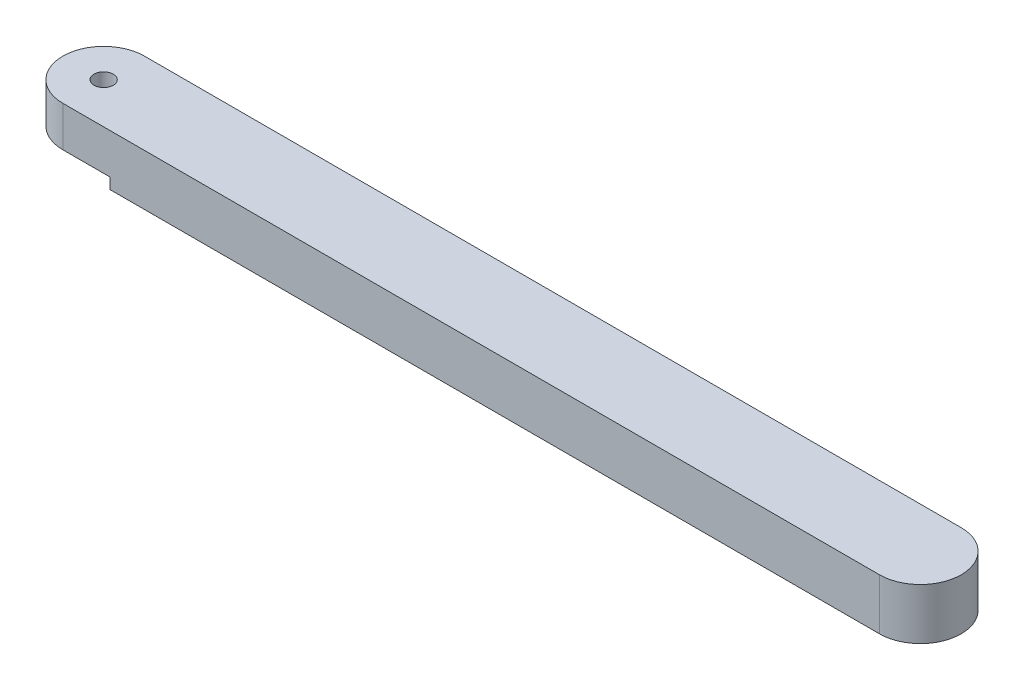
from build123d import *

# Parameters (mm, degrees)
BOSS_EXTRUDE1_DEPTH        = 11.938
F_4_5_4_5_DIAMETER_HOLE1_D = 4.5
CUT_EXTRUDE1_DEPTH         = 2.54


with BuildPart() as part:
    # Sketch1 → Boss-Extrude1 (new body)
    with BuildSketch(Plane(origin=(0, 0, 0), x_dir=(1, 0, 0), z_dir=(0, 1, 0))):
        with BuildLine():
            Line((0, 9.525), (190.5, 9.525))
            ThreePointArc((190.5, 9.525), (200.025, 0), (190.5, -9.525))
            Line((190.5, -9.525), (0, -9.525))
            ThreePointArc((0, -9.525), (-9.525, 0), (0, 9.525))
        make_face()
    extrude(amount=BOSS_EXTRUDE1_DEPTH)

    # Ø4.5 (4.5) Diameter Hole1 (through all)
    with Locations(Plane(origin=(0, 11.938, 0), x_dir=(1, 0, 0), z_dir=(0, 1, 0))):
        with Locations((0, 0)):
            Hole(F_4_5_4_5_DIAMETER_HOLE1_D / 2)

    # Sketch5 → Cut-Extrude1 (cut)
    with BuildSketch(Plane.XZ):
        with BuildLine():
            Line((10.972725624, 9.525), (0, 9.525))
            ThreePointArc((0, 9.525), (-9.525, 0), (0, -9.525))
            Line((0, -9.525), (10.972725624, -9.525))
            Line((10.972725624, -9.525), (10.972725624, -6.985))
            Line((10.972725624, -6.985), (11.934096284, -4.34365582))
            ThreePointArc((11.934096284, -4.34365582), (12.7, 0), (11.934096284, 4.34365582))
            Line((11.934096284, 4.34365582), (10.972725624, 6.985))
            Line((10.972725624, 6.985), (10.972725624, 9.525))
        make_face()
    extrude(amount=-CUT_EXTRUDE1_DEPTH, mode=Mode.SUBTRACT)


solid = part.part
